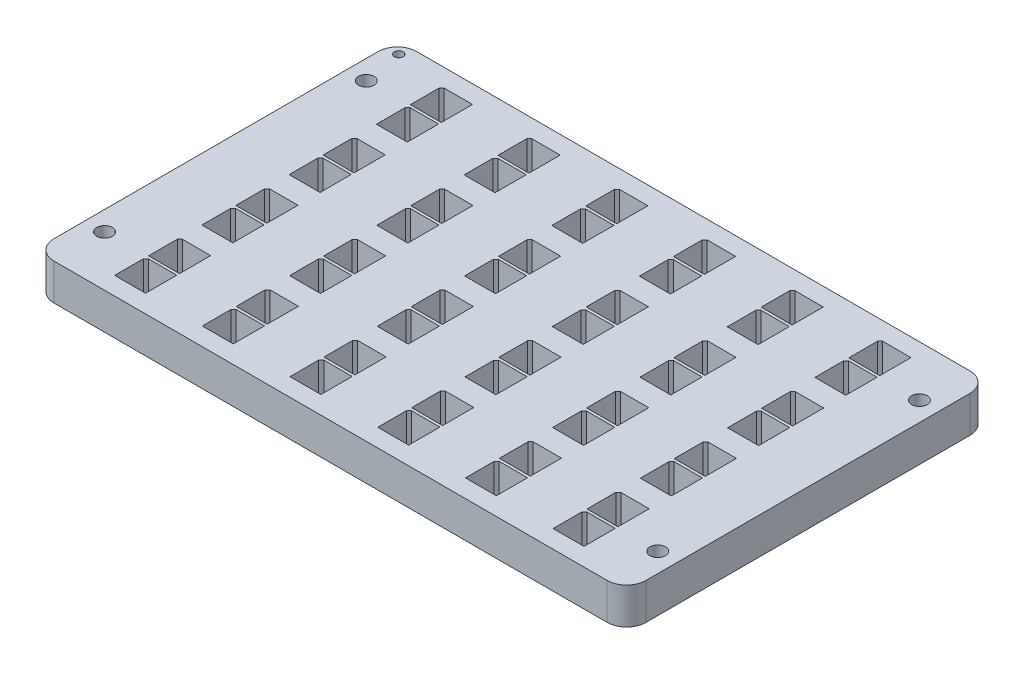
from build123d import *

# Parameters (mm, degrees)
SKETCH1_W           = 122.11
SKETCH1_H           = 74.85
SKETCH1_R           = 1.6
BOSS_EXTRUDE1_DEPTH = 7.5
SKETCH2_R           = 0.899215199
CUT_EXTRUDE1_DEPTH  = 73.004122451
FILLET1_R           = 4


with BuildPart() as part:
    # Sketch1 → Boss-Extrude1 (new body)
    with BuildSketch(Plane(origin=(0, 0, 0), x_dir=(1, 0, 0), z_dir=(0, 1, 0))):
        Rectangle(SKETCH1_W, SKETCH1_H)
        with Locations(Location((-57.055, 26.995, 0), (0, 0, 270))):
            Circle(SKETCH1_R, mode=Mode.SUBTRACT)
        with Locations(Location((57.055, 26.995, 0), (0, 0, 270))):
            Circle(SKETCH1_R, mode=Mode.SUBTRACT)
        with Locations(Location((-57.055, -26.995, 0), (0, 0, 270))):
            Circle(SKETCH1_R, mode=Mode.SUBTRACT)
        with Locations(Location((57.055, -26.995, 0), (0, 0, 270))):
            Circle(SKETCH1_R, mode=Mode.SUBTRACT)
    extrude(amount=BOSS_EXTRUDE1_DEPTH)

    # Sketch2 → Cut-Extrude1 (cut, through all)
    with BuildSketch(Plane(origin=(0, 7.5, 0), x_dir=(1, 0, 0), z_dir=(0, 1, 0))):
        with Locations(Location((-58.44306736, 35.071414061, 0), (0, 0, 270))):
            Circle(SKETCH2_R)
        Polygon((-41.86775, 33.71385), (-47.71975, 33.71385), (-48.24225, 33.19635), (-48.24225, 27.27615), (-41.86775, 27.27615), align=None)
        Polygon((-23.77775, 33.71385), (-23.77775, 27.27615), (-30.15225, 27.27615), (-30.15225, 33.19635), (-29.62975, 33.71385), align=None)
        Polygon((-5.68775, 33.71385), (-5.68775, 27.27615), (-12.06225, 27.27615), (-12.06225, 33.19635), (-11.53975, 33.71385), align=None)
        Polygon((12.40225, 33.71385), (12.40225, 27.27615), (6.02775, 27.27615), (6.02775, 33.19635), (6.55025, 33.71385), align=None)
        Polygon((30.49225, 33.71385), (30.49225, 27.27615), (24.11775, 27.27615), (24.11775, 33.19635), (24.64025, 33.71385), align=None)
        Polygon((48.58225, 33.71385), (48.58225, 27.27615), (42.20775, 27.27615), (42.20775, 33.19635), (42.73025, 33.71385), align=None)
        Polygon((-23.77775, 15.71385), (-23.77775, 9.27615), (-30.15225, 9.27615), (-30.15225, 15.19635), (-29.62975, 15.71385), align=None)
        Polygon((-5.68775, 15.71385), (-5.68775, 9.27615), (-12.06225, 9.27615), (-12.06225, 15.19635), (-11.53975, 15.71385), align=None)
        Polygon((12.40225, 15.71385), (12.40225, 9.27615), (6.02775, 9.27615), (6.02775, 15.19635), (6.55025, 15.71385), align=None)
        Polygon((30.49225, 15.71385), (30.49225, 9.27615), (24.11775, 9.27615), (24.11775, 15.19635), (24.64025, 15.71385), align=None)
        Polygon((48.58225, 15.71385), (48.58225, 9.27615), (42.20775, 9.27615), (42.20775, 15.19635), (42.73025, 15.71385), align=None)
        Polygon((-23.77775, -2.28615), (-23.77775, -8.72385), (-30.15225, -8.72385), (-30.15225, -2.80365), (-29.62975, -2.28615), align=None)
        Polygon((-5.68775, -2.28615), (-5.68775, -8.72385), (-12.06225, -8.72385), (-12.06225, -2.80365), (-11.53975, -2.28615), align=None)
        Polygon((12.40225, -2.28615), (12.40225, -8.72385), (6.02775, -8.72385), (6.02775, -2.80365), (6.55025, -2.28615), align=None)
        Polygon((30.49225, -2.28615), (30.49225, -8.72385), (24.11775, -8.72385), (24.11775, -2.80365), (24.64025, -2.28615), align=None)
        Polygon((48.58225, -2.28615), (48.58225, -8.72385), (42.20775, -8.72385), (42.20775, -2.80365), (42.73025, -2.28615), align=None)
        Polygon((-23.77775, -20.28615), (-23.77775, -26.72385), (-30.15225, -26.72385), (-30.15225, -20.80365), (-29.62975, -20.28615), align=None)
        Polygon((-5.68775, -20.28615), (-5.68775, -26.72385), (-12.06225, -26.72385), (-12.06225, -20.80365), (-11.53975, -20.28615), align=None)
        Polygon((12.40225, -20.28615), (12.40225, -26.72385), (6.02775, -26.72385), (6.02775, -20.80365), (6.55025, -20.28615), align=None)
        Polygon((30.49225, -20.28615), (30.49225, -26.72385), (24.11775, -26.72385), (24.11775, -20.80365), (24.64025, -20.28615), align=None)
        Polygon((48.58225, -20.28615), (48.58225, -26.72385), (42.20775, -26.72385), (42.20775, -20.80365), (42.73025, -20.28615), align=None)
        Polygon((-41.86775, 15.71385), (-41.86775, 9.27615), (-48.24225, 9.27615), (-48.24225, 15.19635), (-47.71975, 15.71385), align=None)
        Polygon((-41.86775, -2.28615), (-41.86775, -8.72385), (-48.24225, -8.72385), (-48.24225, -2.80365), (-47.71975, -2.28615), align=None)
        Polygon((-41.86775, -20.28615), (-41.86775, -26.72385), (-48.24225, -26.72385), (-48.24225, -20.80365), (-47.71975, -20.28615), align=None)
        Polygon((-41.86775, 26.71385), (-47.71975, 26.71385), (-48.24225, 26.19635), (-48.24225, 20.27615), (-41.86775, 20.27615), align=None)
        Polygon((-30.15225, 26.19635), (-30.15225, 20.27615), (-23.77775, 20.27615), (-23.77775, 26.71385), (-29.62975, 26.71385), align=None)
        Polygon((-12.06225, 26.19635), (-12.06225, 20.27615), (-5.68775, 20.27615), (-5.68775, 26.71385), (-11.53975, 26.71385), align=None)
        Polygon((6.02775, 26.19635), (6.02775, 20.27615), (12.40225, 20.27615), (12.40225, 26.71385), (6.55025, 26.71385), align=None)
        Polygon((24.11775, 26.19635), (24.11775, 20.27615), (30.49225, 20.27615), (30.49225, 26.71385), (24.64025, 26.71385), align=None)
        Polygon((42.20775, 26.19635), (42.20775, 20.27615), (48.58225, 20.27615), (48.58225, 26.71385), (42.73025, 26.71385), align=None)
        Polygon((-30.15225, 8.19635), (-30.15225, 2.27615), (-23.77775, 2.27615), (-23.77775, 8.71385), (-29.62975, 8.71385), align=None)
        Polygon((-12.06225, 8.19635), (-12.06225, 2.27615), (-5.68775, 2.27615), (-5.68775, 8.71385), (-11.53975, 8.71385), align=None)
        Polygon((6.02775, 8.19635), (6.02775, 2.27615), (12.40225, 2.27615), (12.40225, 8.71385), (6.55025, 8.71385), align=None)
        Polygon((24.11775, 8.19635), (24.11775, 2.27615), (30.49225, 2.27615), (30.49225, 8.71385), (24.64025, 8.71385), align=None)
        Polygon((42.20775, 8.19635), (42.20775, 2.27615), (48.58225, 2.27615), (48.58225, 8.71385), (42.73025, 8.71385), align=None)
        Polygon((-30.15225, -9.80365), (-30.15225, -15.72385), (-23.77775, -15.72385), (-23.77775, -9.28615), (-29.62975, -9.28615), align=None)
        Polygon((-12.06225, -9.80365), (-12.06225, -15.72385), (-5.68775, -15.72385), (-5.68775, -9.28615), (-11.53975, -9.28615), align=None)
        Polygon((6.02775, -9.80365), (6.02775, -15.72385), (12.40225, -15.72385), (12.40225, -9.28615), (6.55025, -9.28615), align=None)
        Polygon((24.11775, -9.80365), (24.11775, -15.72385), (30.49225, -15.72385), (30.49225, -9.28615), (24.64025, -9.28615), align=None)
        Polygon((42.20775, -9.80365), (42.20775, -15.72385), (48.58225, -15.72385), (48.58225, -9.28615), (42.73025, -9.28615), align=None)
        Polygon((-30.15225, -27.80365), (-30.15225, -33.72385), (-23.77775, -33.72385), (-23.77775, -27.28615), (-29.62975, -27.28615), align=None)
        Polygon((-12.06225, -27.80365), (-12.06225, -33.72385), (-5.68775, -33.72385), (-5.68775, -27.28615), (-11.53975, -27.28615), align=None)
        Polygon((6.02775, -27.80365), (6.02775, -33.72385), (12.40225, -33.72385), (12.40225, -27.28615), (6.55025, -27.28615), align=None)
        Polygon((24.11775, -27.80365), (24.11775, -33.72385), (30.49225, -33.72385), (30.49225, -27.28615), (24.64025, -27.28615), align=None)
        Polygon((42.20775, -27.80365), (42.20775, -33.72385), (48.58225, -33.72385), (48.58225, -27.28615), (42.73025, -27.28615), align=None)
        Polygon((-48.24225, 8.19635), (-48.24225, 2.27615), (-41.86775, 2.27615), (-41.86775, 8.71385), (-47.71975, 8.71385), align=None)
        Polygon((-48.24225, -9.80365), (-48.24225, -15.72385), (-41.86775, -15.72385), (-41.86775, -9.28615), (-47.71975, -9.28615), align=None)
        Polygon((-48.24225, -27.80365), (-48.24225, -33.72385), (-41.86775, -33.72385), (-41.86775, -27.28615), (-47.71975, -27.28615), align=None)
    extrude(amount=-CUT_EXTRUDE1_DEPTH, mode=Mode.SUBTRACT)

    # Fillet1
    fillet1_edges = [part.edges().sort_by_distance(p)[0] for p in [
        (-61.055, 3.75, -37.425),
        (61.055, 3.75, -37.425),
        (61.055, 3.75, 37.425),
        (-61.055, 3.75, 37.425),
    ]]
    fillet(fillet1_edges, radius=FILLET1_R)


solid = part.part
